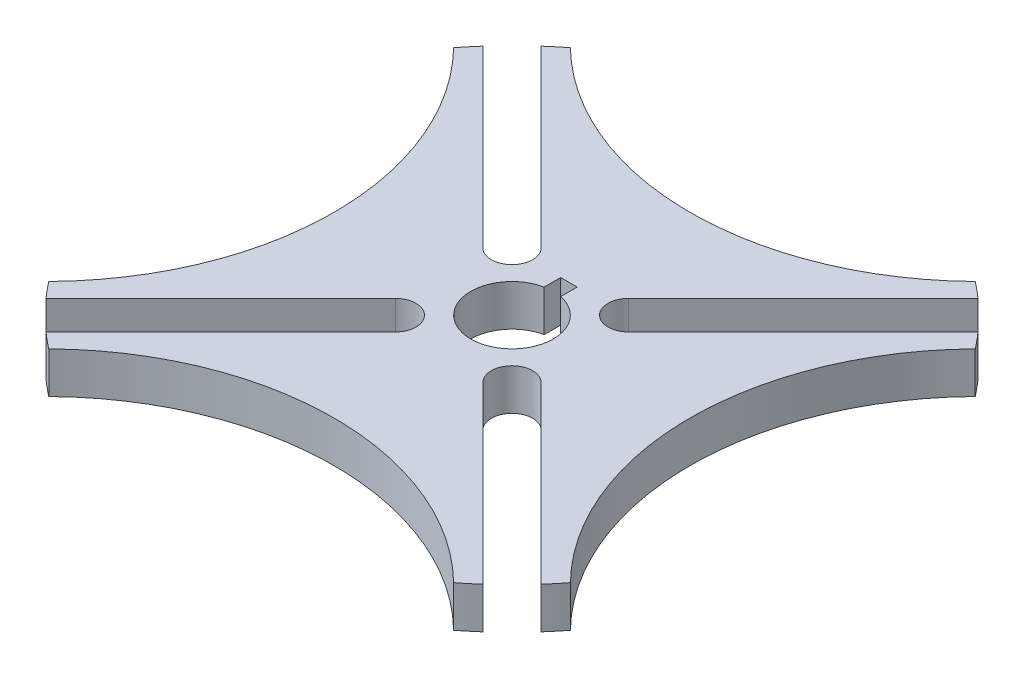
from build123d import *

# Parameters (mm, degrees)
EXTRUDE_1_DEPTH = 10


with BuildPart() as part:
    # 草图1 → 凸台-拉伸1 (new body)
    with BuildSketch(Plane(origin=(0, 0, 0), x_dir=(1, 0, 0), z_dir=(0, 1, 0))):
        with BuildLine():
            Line((59.993482859, 52.922415047), (17.67766953, 10.606601718))
            ThreePointArc((17.67766953, 10.606601718), (10.606601718, 10.606601718), (10.606601718, 17.67766953))
            Line((10.606601718, 17.67766953), (52.922415047, 59.993482859))
            ThreePointArc((52.922415047, 59.993482859), (51.012147139, 61.625975402), (49.05155132, 63.197668573))
            ThreePointArc((49.05155132, 63.197668573), (0, 43.137085), (-49.05155132, 63.197668573))
            ThreePointArc((-49.05155132, 63.197668573), (-51.012147139, 61.625975402), (-52.922415047, 59.993482859))
            Line((-52.922415047, 59.993482859), (-10.606601718, 17.67766953))
            ThreePointArc((-10.606601718, 17.67766953), (-10.606601718, 10.606601718), (-17.67766953, 10.606601718))
            Line((-17.67766953, 10.606601718), (-59.993482859, 52.922415047))
            ThreePointArc((-59.993482859, 52.922415047), (-61.625975402, 51.012147139), (-63.197668573, 49.05155132))
            ThreePointArc((-63.197668573, 49.05155132), (-43.137085, 0), (-63.197668573, -49.05155132))
            ThreePointArc((-63.197668573, -49.05155132), (-61.625975402, -51.012147139), (-59.993482859, -52.922415047))
            Line((-59.993482859, -52.922415047), (-17.67766953, -10.606601718))
            ThreePointArc((-17.67766953, -10.606601718), (-10.606601718, -10.606601718), (-10.606601718, -17.67766953))
            Line((-10.606601718, -17.67766953), (-52.922415047, -59.993482859))
            ThreePointArc((-52.922415047, -59.993482859), (-51.012147139, -61.625975402), (-49.05155132, -63.197668573))
            ThreePointArc((-49.05155132, -63.197668573), (0, -43.137085), (49.05155132, -63.197668573))
            ThreePointArc((49.05155132, -63.197668573), (51.012147139, -61.625975402), (52.922415047, -59.993482859))
            Line((52.922415047, -59.993482859), (10.606601718, -17.67766953))
            ThreePointArc((10.606601718, -17.67766953), (10.606601718, -10.606601718), (17.67766953, -10.606601718))
            Line((17.67766953, -10.606601718), (59.993482859, -52.922415047))
            ThreePointArc((59.993482859, -52.922415047), (61.625975402, -51.012147139), (63.197668573, -49.05155132))
            ThreePointArc((63.197668573, -49.05155132), (43.137085, 0), (63.197668573, 49.05155132))
            ThreePointArc((63.197668573, 49.05155132), (61.625975402, 51.012147139), (59.993482859, 52.922415047))
        make_face()
        with BuildLine():
            Line((-2, 9.797958971), (-2, 13.797958971))
            Line((-2, 13.797958971), (2, 13.797958971))
            Line((2, 13.797958971), (2, 9.797958971))
            ThreePointArc((2, 9.797958971), (0, -10), (-2, 9.797958971))
        make_face(mode=Mode.SUBTRACT)
    extrude(amount=EXTRUDE_1_DEPTH)


solid = part.part
